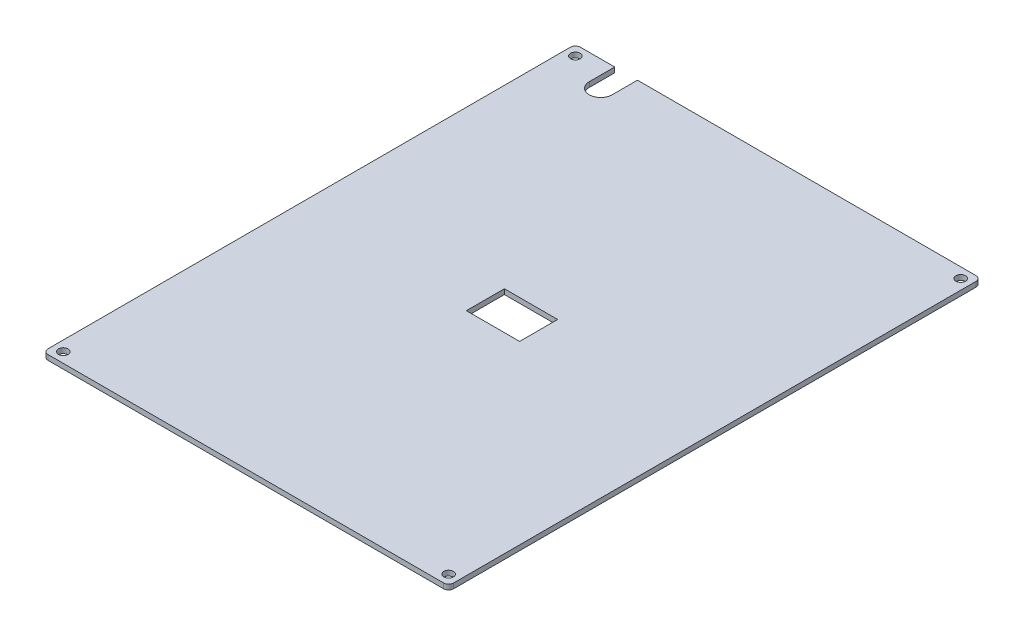
from build123d import *

# Parameters (mm, degrees)
SKETCH1_W           = 160
SKETCH1_H           = 210
BOSS_EXTRUDE1_DEPTH = 2
SKETCH2_R           = 1.9
CUT_EXTRUDE1_DEPTH  = 10
FILLET1_R           = 2
SKETCH3_W           = 21
SKETCH3_H           = 15
CUT_EXTRUDE2_DEPTH  = 10


with BuildPart() as part:
    # Sketch1 → Boss-Extrude1 (new body)
    with BuildSketch(Plane(origin=(0, 0, 0), x_dir=(1, 0, 0), z_dir=(0, 1, 0))):
        with Locations((80, 105)):
            Rectangle(SKETCH1_W, SKETCH1_H)
    extrude(amount=BOSS_EXTRUDE1_DEPTH)

    # Sketch2 → Cut-Extrude1 (cut)
    with BuildSketch(Plane(origin=(0, 2, 0), x_dir=(1, 0, 0), z_dir=(0, 1, 0))):
        with Locations(Location((4, 206, 0), (0, 0, 270))):
            Circle(SKETCH2_R)
        with Locations(Location((156, 206, 0), (0, 0, 90))):
            Circle(SKETCH2_R)
        with Locations(Location((156, 4, 0), (0, 0, 270))):
            Circle(SKETCH2_R)
        with Locations(Location((4, 4, 0), (0, 0, 90))):
            Circle(SKETCH2_R)
        with BuildLine():
            Line((24.5, 200), (24.5, 210))
            Line((24.5, 210), (15.5, 210))
            Line((15.5, 210), (15.5, 200))
            ThreePointArc((15.5, 200), (20, 195.5), (24.5, 200))
        make_face()
    extrude(amount=-CUT_EXTRUDE1_DEPTH, mode=Mode.SUBTRACT)

    # Fillet1
    fillet1_edges = [part.edges().sort_by_distance(p)[0] for p in [
        (0, 1, -210),
        (160, 1, -210),
        (160, 1, 0),
        (0, 1, 0),
    ]]
    fillet(fillet1_edges, radius=FILLET1_R)

    # Sketch3 → Cut-Extrude2 (cut)
    with BuildSketch(Plane(origin=(0, 2, 0), x_dir=(1, 0, 0), z_dir=(0, 1, 0))):
        with Locations((80, 105)):
            Rectangle(SKETCH3_W, SKETCH3_H)
    extrude(amount=-CUT_EXTRUDE2_DEPTH, mode=Mode.SUBTRACT)


solid = part.part
